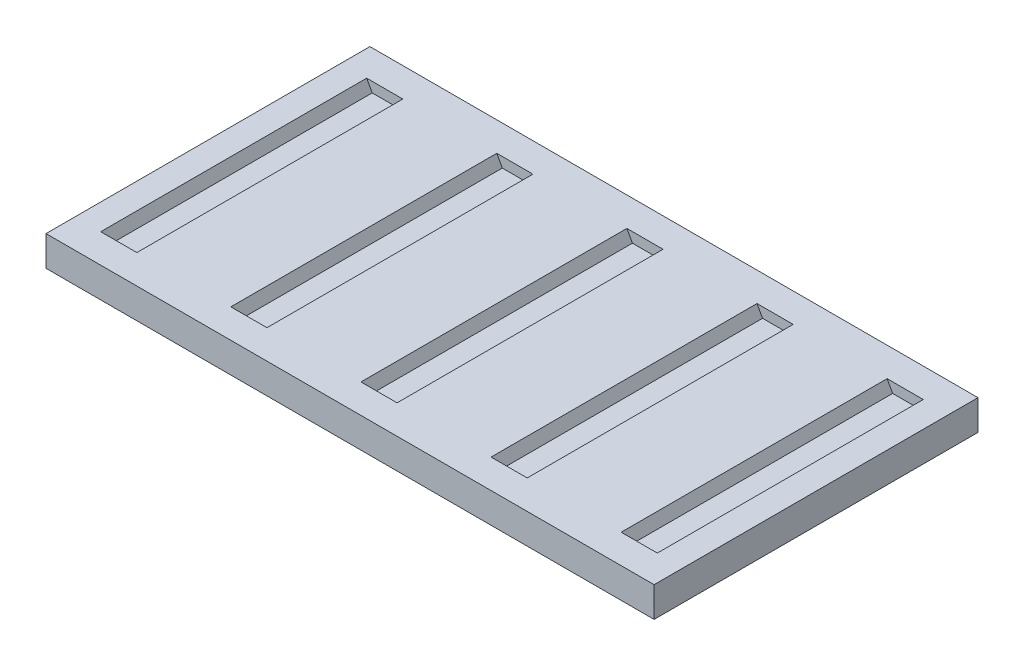
from build123d import *

# Parameters (mm, degrees)
EXTRUDE_1_DEPTH     = 60
SKETCH_9_W          = 242.360715673
SKETCH_9_H          = 17.5
SKETCH_9_R          = 2.1
EXTRUDE_2_DEPTH     = 3
SKETCH_13_W         = 242.360715673
SKETCH_13_H         = 16
SKETCH_13_R         = 2.1
EXTRUDE_3_DEPTH     = 1.55
SKETCH_14_W         = 242.360715673
SKETCH_14_H         = 129.1
SKETCH_14_R         = 2.1
EXTRUDE_4_DEPTH     = 3
SKETCH_15_W         = 222.641049517
SKETCH_15_H         = 9.29970853
EXTRUDE_5_DEPTH     = 129.1
SKETCH_16_W         = 242.360715673
SKETCH_16_H         = 33.21324475
EXTRUDE_6_DEPTH     = 3
SKETCH_18_W         = 242.360715673
SKETCH_18_H         = 20.5
EXTRUDE_7_DEPTH     = 126.1
SKETCH_19_W         = 242.360715673
SKETCH_19_H         = 8.5
CUT_EXTRUDE_1_DEPTH = 276.18998256
CUT_EXTRUDE_2_DEPTH = 53


with BuildPart() as part:
    # ｽｹｯﾁ5 → ﾎﾞｽ - 押し出し1 (new body)
    with BuildSketch(Plane.XY.offset(-1.55)):
        with BuildLine():
            Line((242.360715673, -15), (242.360715673, -2.976))
            Line((242.360715673, -2.976), (240.239284327, -2.976))
            ThreePointArc((240.239284327, -2.976), (239.45348461, -2.728238301), (238.951905437, -2.074567596))
            Line((238.951905437, -2.074567596), (238.196824583, 0))
            Line((238.196824583, 0), (231.703175417, 0))
            Line((231.703175417, 0), (230.948094563, -2.074567596))
            ThreePointArc((230.948094563, -2.074567596), (230.44651539, -2.728238301), (229.660715673, -2.976))
            Line((229.660715673, -2.976), (227.539284327, -2.976))
            ThreePointArc((227.539284327, -2.976), (226.75348461, -2.728238301), (226.251905437, -2.074567596))
            Line((226.251905437, -2.074567596), (225.496824583, 0))
            Line((225.496824583, 0), (219.003175417, 0))
            Line((219.003175417, 0), (218.248094563, -2.074567596))
            ThreePointArc((218.248094563, -2.074567596), (217.74651539, -2.728238301), (216.960715673, -2.976))
            Line((216.960715673, -2.976), (214.839284327, -2.976))
            ThreePointArc((214.839284327, -2.976), (214.05348461, -2.728238301), (213.551905437, -2.074567596))
            Line((213.551905437, -2.074567596), (212.796824583, 0))
            Line((212.796824583, 0), (206.303175417, 0))
            Line((206.303175417, 0), (205.548094563, -2.074567596))
            ThreePointArc((205.548094563, -2.074567596), (205.04651539, -2.728238301), (204.260715673, -2.976))
            Line((204.260715673, -2.976), (202.139284327, -2.976))
            ThreePointArc((202.139284327, -2.976), (201.35348461, -2.728238301), (200.851905437, -2.074567596))
            Line((200.851905437, -2.074567596), (200.096824583, 0))
            Line((200.096824583, 0), (193.603175417, 0))
            Line((193.603175417, 0), (192.848094563, -2.074567596))
            ThreePointArc((192.848094563, -2.074567596), (192.34651539, -2.728238301), (191.560715673, -2.976))
            Line((191.560715673, -2.976), (189.439284327, -2.976))
            ThreePointArc((189.439284327, -2.976), (188.65348461, -2.728238301), (188.151905437, -2.074567596))
            Line((188.151905437, -2.074567596), (187.396824583, 0))
            Line((187.396824583, 0), (180.903175417, 0))
            Line((180.903175417, 0), (180.148094563, -2.074567596))
            ThreePointArc((180.148094563, -2.074567596), (179.64651539, -2.728238301), (178.860715673, -2.976))
            Line((178.860715673, -2.976), (176.739284327, -2.976))
            ThreePointArc((176.739284327, -2.976), (175.95348461, -2.728238301), (175.451905437, -2.074567596))
            Line((175.451905437, -2.074567596), (174.696824583, 0))
            Line((174.696824583, 0), (168.203175417, 0))
            Line((168.203175417, 0), (167.448094563, -2.074567596))
            ThreePointArc((167.448094563, -2.074567596), (166.94651539, -2.728238301), (166.160715673, -2.976))
            Line((166.160715673, -2.976), (164.039284327, -2.976))
            ThreePointArc((164.039284327, -2.976), (163.25348461, -2.728238301), (162.751905437, -2.074567596))
            Line((162.751905437, -2.074567596), (161.996824583, 0))
            Line((161.996824583, 0), (155.503175417, 0))
            Line((155.503175417, 0), (154.748094563, -2.074567596))
            ThreePointArc((154.748094563, -2.074567596), (154.24651539, -2.728238301), (153.460715673, -2.976))
            Line((153.460715673, -2.976), (151.339284327, -2.976))
            ThreePointArc((151.339284327, -2.976), (150.55348461, -2.728238301), (150.051905437, -2.074567596))
            Line((150.051905437, -2.074567596), (149.296824583, 0))
            Line((149.296824583, 0), (142.803175417, 0))
            Line((142.803175417, 0), (142.048094563, -2.074567596))
            ThreePointArc((142.048094563, -2.074567596), (141.54651539, -2.728238301), (140.760715673, -2.976))
            Line((140.760715673, -2.976), (138.639284327, -2.976))
            ThreePointArc((138.639284327, -2.976), (137.85348461, -2.728238301), (137.351905437, -2.074567596))
            Line((137.351905437, -2.074567596), (136.596824583, 0))
            Line((136.596824583, 0), (130.103175417, 0))
            Line((130.103175417, 0), (129.348094563, -2.074567596))
            ThreePointArc((129.348094563, -2.074567596), (128.84651539, -2.728238301), (128.060715673, -2.976))
            Line((128.060715673, -2.976), (125.939284327, -2.976))
            ThreePointArc((125.939284327, -2.976), (125.15348461, -2.728238301), (124.651905437, -2.074567596))
            Line((124.651905437, -2.074567596), (123.896824583, 0))
            Line((123.896824583, 0), (117.403175417, 0))
            Line((117.403175417, 0), (116.648094563, -2.074567596))
            ThreePointArc((116.648094563, -2.074567596), (116.14651539, -2.728238301), (115.360715673, -2.976))
            Line((115.360715673, -2.976), (113.239284327, -2.976))
            ThreePointArc((113.239284327, -2.976), (112.45348461, -2.728238301), (111.951905437, -2.074567596))
            Line((111.951905437, -2.074567596), (111.196824583, 0))
            Line((111.196824583, 0), (104.703175417, 0))
            Line((104.703175417, 0), (103.948094563, -2.074567596))
            ThreePointArc((103.948094563, -2.074567596), (103.44651539, -2.728238301), (102.660715673, -2.976))
            Line((102.660715673, -2.976), (100.539284327, -2.976))
            ThreePointArc((100.539284327, -2.976), (99.75348461, -2.728238301), (99.251905437, -2.074567596))
            Line((99.251905437, -2.074567596), (98.496824583, 0))
            Line((98.496824583, 0), (92.003175417, 0))
            Line((92.003175417, 0), (91.248094563, -2.074567596))
            ThreePointArc((91.248094563, -2.074567596), (90.74651539, -2.728238301), (89.960715673, -2.976))
            Line((89.960715673, -2.976), (87.839284327, -2.976))
            ThreePointArc((87.839284327, -2.976), (87.05348461, -2.728238301), (86.551905437, -2.074567596))
            Line((86.551905437, -2.074567596), (85.796824583, 0))
            Line((85.796824583, 0), (79.303175417, 0))
            Line((79.303175417, 0), (78.548094563, -2.074567596))
            ThreePointArc((78.548094563, -2.074567596), (78.04651539, -2.728238301), (77.260715673, -2.976))
            Line((77.260715673, -2.976), (75.139284327, -2.976))
            ThreePointArc((75.139284327, -2.976), (74.35348461, -2.728238301), (73.851905437, -2.074567596))
            Line((73.851905437, -2.074567596), (73.096824583, 0))
            Line((73.096824583, 0), (66.603175417, 0))
            Line((66.603175417, 0), (65.848094563, -2.074567596))
            ThreePointArc((65.848094563, -2.074567596), (65.34651539, -2.728238301), (64.560715673, -2.976))
            Line((64.560715673, -2.976), (62.439284327, -2.976))
            ThreePointArc((62.439284327, -2.976), (61.65348461, -2.728238301), (61.151905437, -2.074567596))
            Line((61.151905437, -2.074567596), (60.396824583, 0))
            Line((60.396824583, 0), (53.903175417, 0))
            Line((53.903175417, 0), (53.148094563, -2.074567596))
            ThreePointArc((53.148094563, -2.074567596), (52.64651539, -2.728238301), (51.860715673, -2.976))
            Line((51.860715673, -2.976), (49.739284327, -2.976))
            ThreePointArc((49.739284327, -2.976), (48.95348461, -2.728238301), (48.451905437, -2.074567596))
            Line((48.451905437, -2.074567596), (47.696824583, 0))
            Line((47.696824583, 0), (41.203175417, 0))
            Line((41.203175417, 0), (40.448094563, -2.074567596))
            ThreePointArc((40.448094563, -2.074567596), (39.94651539, -2.728238301), (39.160715673, -2.976))
            Line((39.160715673, -2.976), (37.039284327, -2.976))
            ThreePointArc((37.039284327, -2.976), (36.25348461, -2.728238301), (35.751905437, -2.074567596))
            Line((35.751905437, -2.074567596), (34.996824583, 0))
            Line((34.996824583, 0), (28.503175417, 0))
            Line((28.503175417, 0), (27.748094563, -2.074567596))
            ThreePointArc((27.748094563, -2.074567596), (27.24651539, -2.728238301), (26.460715673, -2.976))
            Line((26.460715673, -2.976), (24.339284327, -2.976))
            ThreePointArc((24.339284327, -2.976), (23.55348461, -2.728238301), (23.051905437, -2.074567596))
            Line((23.051905437, -2.074567596), (22.296824583, 0))
            Line((22.296824583, 0), (15.803175417, 0))
            Line((15.803175417, 0), (15.048094563, -2.074567596))
            ThreePointArc((15.048094563, -2.074567596), (14.54651539, -2.728238301), (13.760715673, -2.976))
            Line((13.760715673, -2.976), (11.639284327, -2.976))
            ThreePointArc((11.639284327, -2.976), (10.85348461, -2.728238301), (10.351905437, -2.074567596))
            Line((10.351905437, -2.074567596), (9.596824583, 0))
            Line((9.596824583, 0), (3.103175417, 0))
            Line((3.103175417, 0), (2.348094563, -2.074567596))
            ThreePointArc((2.348094563, -2.074567596), (1.84651539, -2.728238301), (1.060715673, -2.976))
            Line((1.060715673, -2.976), (0, -2.976))
            Line((0, -2.976), (0, -15))
            Line((0, -15), (242.360715673, -15))
        make_face()
    extrude(amount=-EXTRUDE_1_DEPTH)


with BuildPart() as body_2:
    # ｽｹｯﾁ9 → ﾎﾞｽ - 押し出し2 (new body)
    with BuildSketch(Plane(origin=(0, 0, -61.55), x_dir=(-1, 0, 0), z_dir=(0, 0, -1))):
        with Locations((-121.180357837, -6.25)):
            Rectangle(SKETCH_9_W, SKETCH_9_H)
        with Locations((-25, -7)):
            Circle(SKETCH_9_R, mode=Mode.SUBTRACT)
        with Locations((-85, -7)):
            Circle(SKETCH_9_R, mode=Mode.SUBTRACT)
        with Locations(Location((-157.360715673, -7, 0), (0, 0, 180))):
            Circle(SKETCH_9_R, mode=Mode.SUBTRACT)
        with Locations(Location((-217.360715673, -7, 0), (0, 0, 180))):
            Circle(SKETCH_9_R, mode=Mode.SUBTRACT)
    extrude(amount=EXTRUDE_2_DEPTH)


with BuildPart() as body_3:
    # ｽｹｯﾁ13 → ﾎﾞｽ - 押し出し3 (new, symmetric)
    with BuildSketch(Plane.XY):
        with Locations((121.180357837, -7)):
            Rectangle(SKETCH_13_W, SKETCH_13_H)
        with Locations(Location((85, -7, 0), (0, 0, 180))):
            Circle(SKETCH_13_R, mode=Mode.SUBTRACT)
        with Locations(Location((25, -7, 0), (0, 0, 180))):
            Circle(SKETCH_13_R, mode=Mode.SUBTRACT)
        with Locations((217.360715673, -7)):
            Circle(SKETCH_13_R, mode=Mode.SUBTRACT)
        with Locations((157.360715673, -7)):
            Circle(SKETCH_13_R, mode=Mode.SUBTRACT)
    extrude(amount=EXTRUDE_3_DEPTH, both=True)


with BuildPart() as body_4:
    # ﾐﾗｰ1: mirrored copy
    add(part.part.mirror(Plane.XY))


with BuildPart() as body_5:
    # Mirror 1 2: mirrored copy
    add(body_2.part.mirror(Plane.XY))


with BuildPart() as body_6:
    # ｽｹｯﾁ14 → ﾎﾞｽ - 押し出し4 (new body)
    with BuildSketch(Plane.XZ.offset(15)):
        with Locations((121.180357837, 0)):
            Rectangle(SKETCH_14_W, SKETCH_14_H)
        with Locations(Location((7, 31.55, 0), (0, 0, 180))):
            Circle(SKETCH_14_R, mode=Mode.SUBTRACT)
        with Locations((121.5, -31.55)):
            Circle(SKETCH_14_R, mode=Mode.SUBTRACT)
        with Locations((235.360715673, -31.55)):
            Circle(SKETCH_14_R, mode=Mode.SUBTRACT)
        with Locations((7, -31.55)):
            Circle(SKETCH_14_R, mode=Mode.SUBTRACT)
        with Locations(Location((235.360715673, 31.55, 0), (0, 0, 180))):
            Circle(SKETCH_14_R, mode=Mode.SUBTRACT)
        with Locations(Location((121.5, 31.55, 0), (0, 0, 180))):
            Circle(SKETCH_14_R, mode=Mode.SUBTRACT)
    extrude(amount=EXTRUDE_4_DEPTH)


with BuildPart() as body_4_1:
    add(body_4.part)

    # Combine 2: union part, body 5, body 6, body 3, body 2
    add(part.part)
    add(body_5.part)
    add(body_6.part)
    add(body_3.part)
    add(body_2.part)

    # ｽｹｯﾁ15 → ﾎﾞｽ - 押し出し5 (add)
    with BuildSketch(Plane(origin=(0, 0, -64.55), x_dir=(-1, 0, 0), z_dir=(0, 0, -1))):
        with Locations((-117.248229002, -7.625854265)):
            Rectangle(SKETCH_15_W, SKETCH_15_H)
    extrude(amount=-EXTRUDE_5_DEPTH)

    # ｽｹｯﾁ16 → ﾎﾞｽ - 押し出し6 (add)
    with BuildSketch(Plane.XZ.offset(18)):
        with Locations((121.180357837, 1.195676811)):
            Rectangle(SKETCH_16_W, SKETCH_16_H)
    extrude(amount=-EXTRUDE_6_DEPTH)

    # ｽｹｯﾁ18 → ﾎﾞｽ - 押し出し7 (add)
    with BuildSketch(Plane.XY.offset(64.55)):
        with Locations((121.180357837, -7.75)):
            Rectangle(SKETCH_18_W, SKETCH_18_H)
    extrude(amount=-EXTRUDE_7_DEPTH)

    # ｽｹｯﾁ19 → ｶｯﾄ - 押し出し1 (cut, through all)
    with BuildSketch(Plane.XY.offset(64.55)):
        with Locations((121.180357837, -1.75)):
            Rectangle(SKETCH_19_W, SKETCH_19_H)
    extrude(amount=-CUT_EXTRUDE_1_DEPTH, mode=Mode.SUBTRACT)

    # ｽｹｯﾁ17 → ｶｯﾄ - 押し出し2 (cut, symmetric)
    with BuildSketch(Plane.XY):
        Polygon((6.960357836, 0), (27.960357836, 0), (22.460357836, -10), (12.460357836, -10), align=None)
        Polygon((58.820357836, 0), (79.820357836, 0), (74.320357836, -10), (64.320357836, -10), align=None)
        Polygon((110.680357836, 0), (131.680357836, 0), (126.180357836, -10), (116.180357836, -10), align=None)
        Polygon((162.540357836, 0), (183.540357836, 0), (178.040357836, -10), (168.040357836, -10), align=None)
        Polygon((214.400357836, 0), (235.400357836, 0), (229.900357836, -10), (219.900357836, -10), align=None)
    extrude(amount=CUT_EXTRUDE_2_DEPTH, both=True, mode=Mode.SUBTRACT)


solid = body_4_1.part
